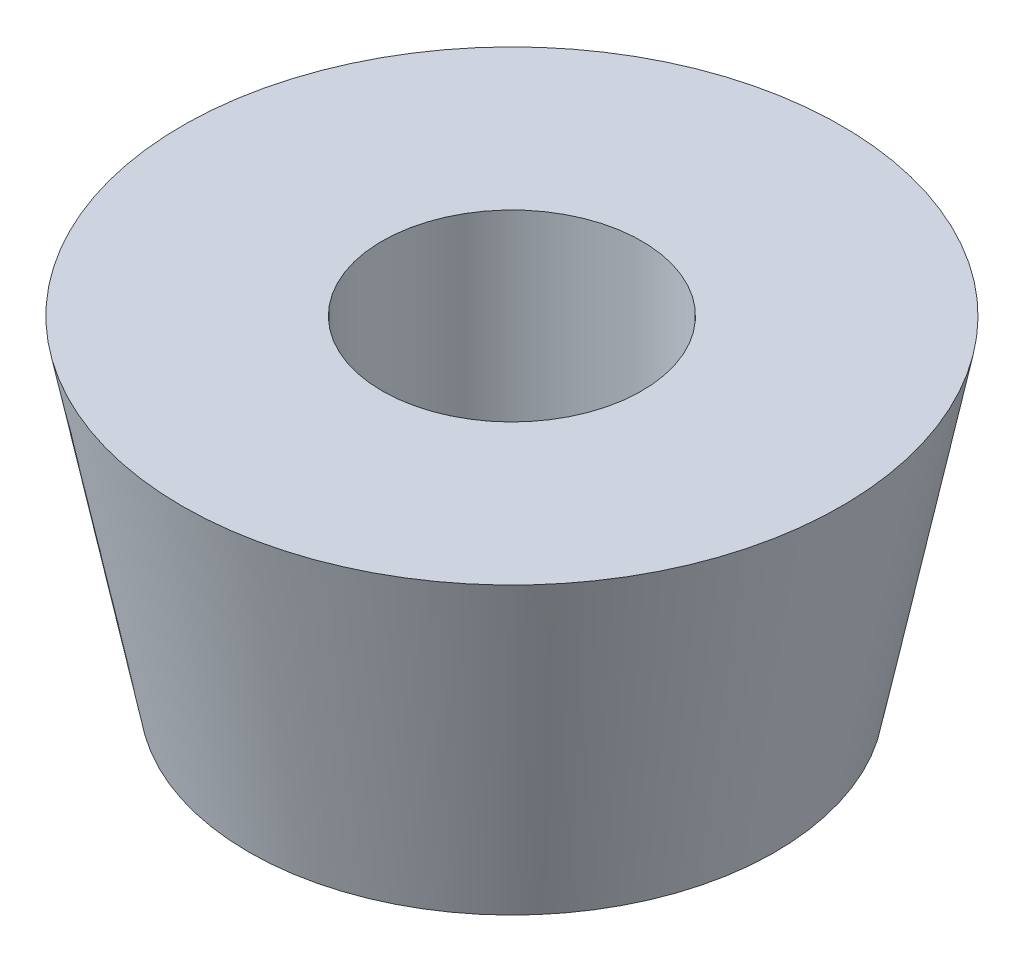
from build123d import *


with BuildPart() as part:
    # Sketch1 → Revolve1 (revolve)
    with BuildSketch(Plane.XY, mode=Mode.PRIVATE) as revolve1_sk:
        Polygon((1.95, 0), (1.95, -5), (3.95, -5), (4.95, 0), align=None)
    revolve(revolve1_sk.sketch.rotate(Axis((0, 0, 0), (0, -1, 0)), 90), axis=Axis((0, 0, 0), (0, -1, 0)))


solid = part.part
